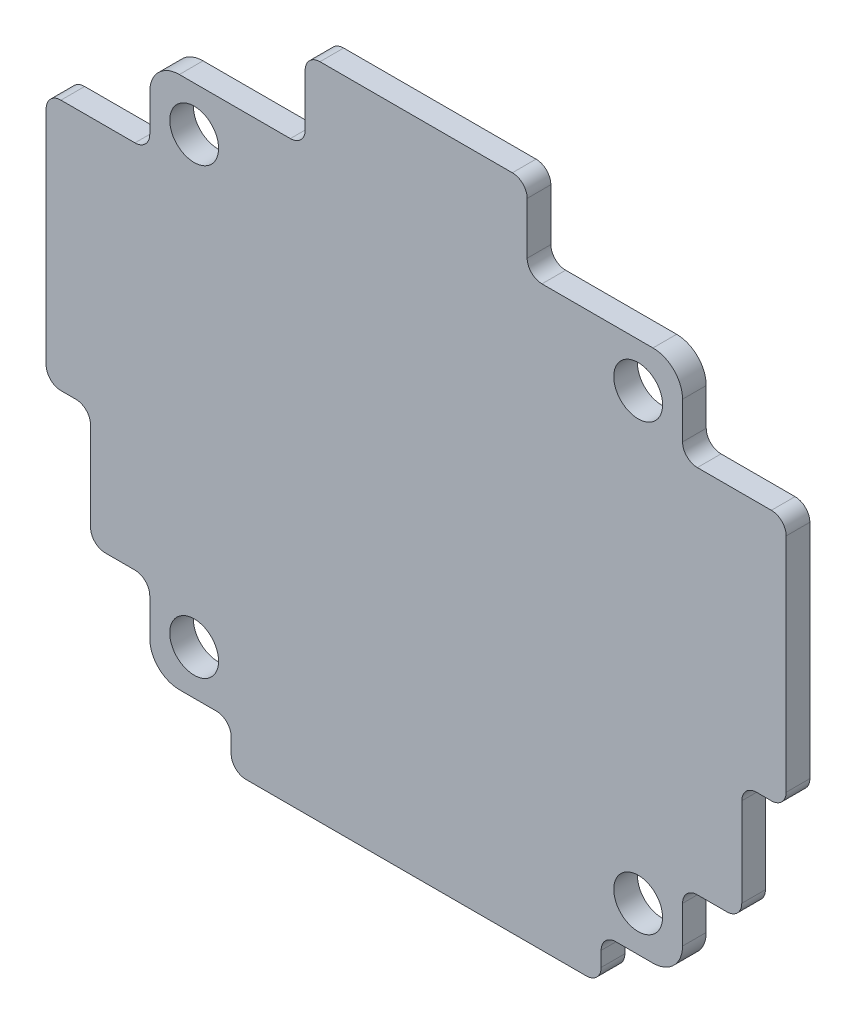
from build123d import *

# Parameters (mm, degrees)
SKETCH_1_W               = 36
SKETCH_1_H               = 36
BODY_DEPTH               = 1.6
SKETCH_2_R               = 1.65
BOLTHOLE_M3_PILLAR_DEPTH = 26.506077707
FILLET_1_R               = 2
SKETCH_4_W               = 15
SKETCH_4_H               = 5.5
SKETCH_4_W_2             = 25
SKETCH_4_H_2             = 3
CONNECTORS_POWER_DEPTH   = 1.6
FILLET_3_R               = 1


with BuildPart() as part:
    # 스케치1 → Body (new body)
    with BuildSketch(Plane.XY):
        Rectangle(SKETCH_1_W, SKETCH_1_H)
    extrude(amount=BODY_DEPTH)

    # 스케치2 → BoltHole_M3_pillar (cut, through all)
    with BuildSketch(Plane.XY.offset(1.6)):
        with Locations((-15, 15)):
            Circle(SKETCH_2_R)
        with Locations((15, 15)):
            Circle(SKETCH_2_R)
        with Locations((15, -15)):
            Circle(SKETCH_2_R)
        with Locations((-15, -15)):
            Circle(SKETCH_2_R)
    extrude(amount=-BOLTHOLE_M3_PILLAR_DEPTH, mode=Mode.SUBTRACT)

    # 필렛1
    fillet_1_edges = [part.edges().sort_by_distance(p)[0] for p in [
        (-18, 18, 0.8),
        (18, 18, 0.8),
        (18, -18, 0.8),
        (-18, -18, 0.8),
    ]]
    fillet(fillet_1_edges, radius=FILLET_1_R)

    # 스케치4 → Connectors_power (add)
    with BuildSketch(Plane.XY):
        Polygon((-18, 12.5), (-25, 12.5), (-25, -4.5), (-22, -4.5), (-22, -12.5), (-18, -12.5), (-18, -4.5), align=None)
        Polygon((25, 12.5), (25, -4.5), (22, -4.5), (22, -12.5), (18, -12.5), (18, -4.5), (18, 12.5), align=None)
        with Locations((0, 20.75)):
            Rectangle(SKETCH_4_W, SKETCH_4_H)
        with Locations((0, -19.5)):
            Rectangle(SKETCH_4_W_2, SKETCH_4_H_2)
    extrude(amount=CONNECTORS_POWER_DEPTH)

    # 필렛3
    fillet_3_edges = [part.edges().sort_by_distance(p)[0] for p in [
        (12.5, -18, 0.8),
        (12.5, -21, 0.8),
        (-12.5, -21, 0.8),
        (-12.5, -18, 0.8),
        (-18, -12.5, 0.8),
        (-22, -12.5, 0.8),
        (-22, -4.5, 0.8),
        (-25, -4.5, 0.8),
        (-25, 12.5, 0.8),
        (-18, 12.5, 0.8),
        (25, -4.5, 0.8),
        (22, -4.5, 0.8),
        (22, -12.5, 0.8),
        (18, -12.5, 0.8),
        (18, 12.5, 0.8),
        (25, 12.5, 0.8),
        (7.5, 23.5, 0.8),
        (7.5, 18, 0.8),
        (-7.5, 18, 0.8),
        (-7.5, 23.5, 0.8),
    ]]
    fillet(fillet_3_edges, radius=FILLET_3_R)


solid = part.part
